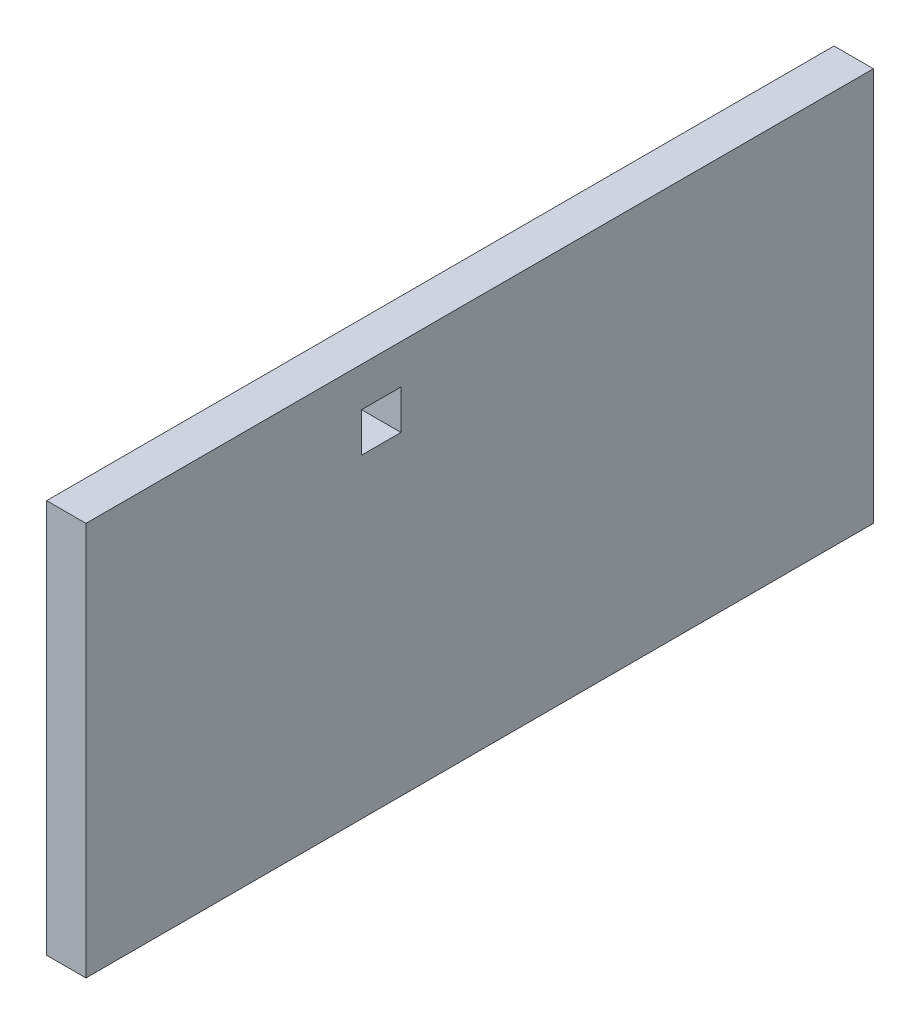
from build123d import *

# Parameters (mm, degrees)
SKETCH1_W           = 1000
SKETCH1_H           = 1000
BOSS_EXTRUDE1_DEPTH = 50
SKETCH2_W           = 100
SKETCH2_H           = 100
CUT_EXTRUDE1_DEPTH  = 1123.497216032
SKETCH3_W           = 1000
SKETCH3_H           = 1000
BOSS_EXTRUDE2_DEPTH = 50


with BuildPart() as part:
    # Sketch1 → Boss-Extrude1 (new, symmetric)
    with BuildSketch(Plane.YZ):
        with Locations((0, 500)):
            Rectangle(SKETCH1_W, SKETCH1_H)
    extrude(amount=BOSS_EXTRUDE1_DEPTH, both=True)

    # Sketch2 → Cut-Extrude1 (cut, through all)
    with BuildSketch(Plane(origin=(50, 0, 0), x_dir=(0, 0, -1), z_dir=(1, 0, 0))):
        with Locations((-250, 350)):
            Rectangle(SKETCH2_W, SKETCH2_H)
    extrude(amount=-CUT_EXTRUDE1_DEPTH, mode=Mode.SUBTRACT)

    # Sketch3 → Boss-Extrude2 (add, symmetric)
    with BuildSketch(Plane.YZ):
        with Locations((0, -500)):
            Rectangle(SKETCH3_W, SKETCH3_H)
    extrude(amount=BOSS_EXTRUDE2_DEPTH, both=True)


solid = part.part
